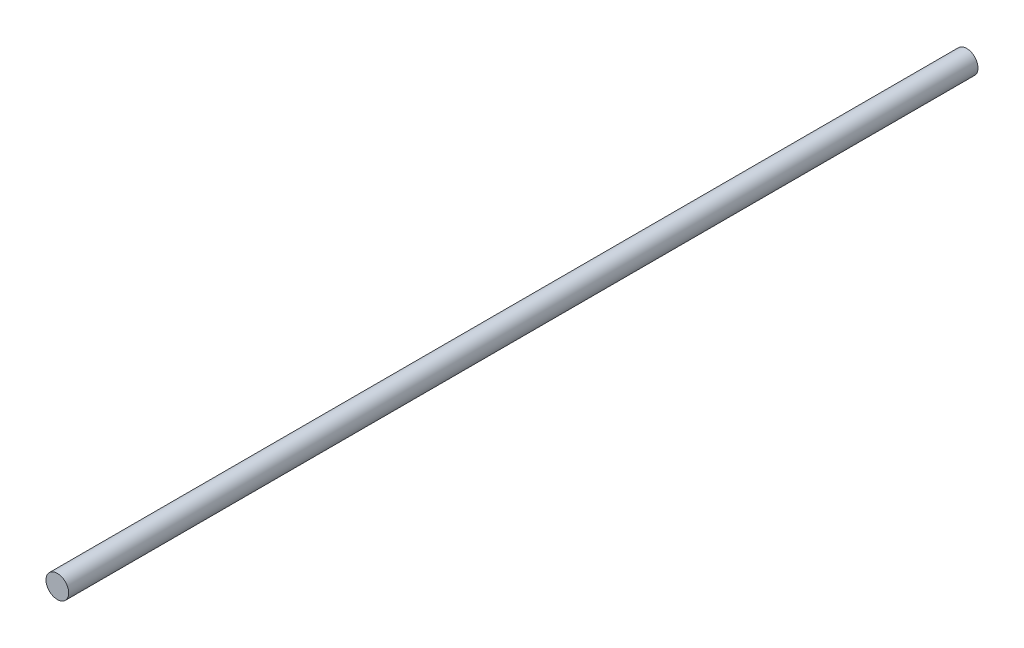
from build123d import *

# Parameters (mm, degrees)
ESQUISSE1_R        = 1.5
BOSS_EXTRU_1_DEPTH = 120


with BuildPart() as part:
    # Esquisse1 → Boss.-Extru.1 (new body)
    with BuildSketch(Plane.XY):
        Circle(ESQUISSE1_R)
    extrude(amount=BOSS_EXTRU_1_DEPTH)


solid = part.part
